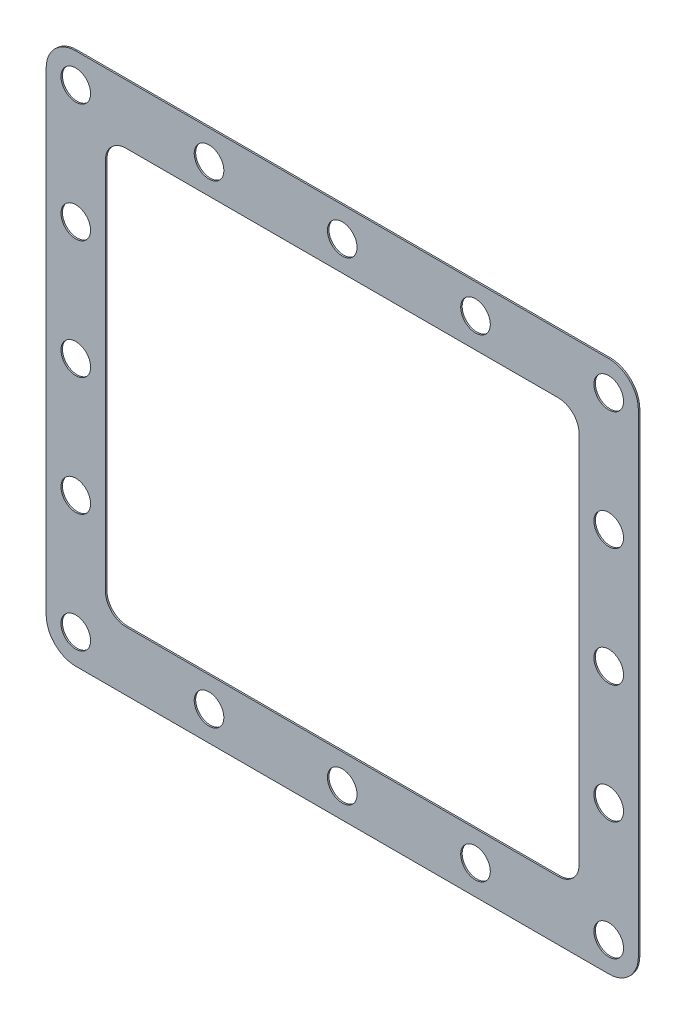
from build123d import *

# Parameters (mm, degrees)
SKETCH_1_R      = 5
EXTRUDE_1_DEPTH = 0.5


with BuildPart() as part:
    # 草图1 → 凸台-拉伸1 (new body)
    with BuildSketch(Plane.XY):
        with BuildLine():
            Line((-90, -90), (90, -90))
            ThreePointArc((90, -90), (97.071067812, -87.071067812), (100, -80))
            Line((100, -80), (100, 80))
            ThreePointArc((100, 80), (97.071067812, 87.071067812), (90, 90))
            Line((90, 90), (-90, 90))
            ThreePointArc((-90, 90), (-97.071067812, 87.071067812), (-100, 80))
            Line((-100, 80), (-100, -80))
            ThreePointArc((-100, -80), (-97.071067812, -87.071067812), (-90, -90))
        make_face()
        with Locations((90, -80)):
            Circle(SKETCH_1_R, mode=Mode.SUBTRACT)
        with Locations((90, 80)):
            Circle(SKETCH_1_R, mode=Mode.SUBTRACT)
        with Locations((-90, 80)):
            Circle(SKETCH_1_R, mode=Mode.SUBTRACT)
        with Locations((-90, -80)):
            Circle(SKETCH_1_R, mode=Mode.SUBTRACT)
        with Locations((90, 0)):
            Circle(SKETCH_1_R, mode=Mode.SUBTRACT)
        with Locations((90, -40)):
            Circle(SKETCH_1_R, mode=Mode.SUBTRACT)
        with Locations((90, 40)):
            Circle(SKETCH_1_R, mode=Mode.SUBTRACT)
        with Locations(Location((-90, -40, 0), (0, 0, 180))):
            Circle(SKETCH_1_R, mode=Mode.SUBTRACT)
        with Locations(Location((-90, 0, 0), (0, 0, 180))):
            Circle(SKETCH_1_R, mode=Mode.SUBTRACT)
        with Locations(Location((-90, 40, 0), (0, 0, 180))):
            Circle(SKETCH_1_R, mode=Mode.SUBTRACT)
        with Locations((0, 80)):
            Circle(SKETCH_1_R, mode=Mode.SUBTRACT)
        with Locations((-45, 80)):
            Circle(SKETCH_1_R, mode=Mode.SUBTRACT)
        with Locations((45, 80)):
            Circle(SKETCH_1_R, mode=Mode.SUBTRACT)
        with Locations((0, -80)):
            Circle(SKETCH_1_R, mode=Mode.SUBTRACT)
        with Locations((-45, -80)):
            Circle(SKETCH_1_R, mode=Mode.SUBTRACT)
        with Locations((45, -80)):
            Circle(SKETCH_1_R, mode=Mode.SUBTRACT)
        with BuildLine():
            Line((-73, -70), (73, -70))
            ThreePointArc((73, -70), (77.949747468, -67.949747468), (80, -63))
            Line((80, -63), (80, 63))
            ThreePointArc((80, 63), (77.949747468, 67.949747468), (73, 70))
            Line((73, 70), (-73, 70))
            ThreePointArc((-73, 70), (-77.949747468, 67.949747468), (-80, 63))
            Line((-80, 63), (-80, -63))
            ThreePointArc((-80, -63), (-77.949747468, -67.949747468), (-73, -70))
        make_face(mode=Mode.SUBTRACT)
    extrude(amount=EXTRUDE_1_DEPTH)


solid = part.part
